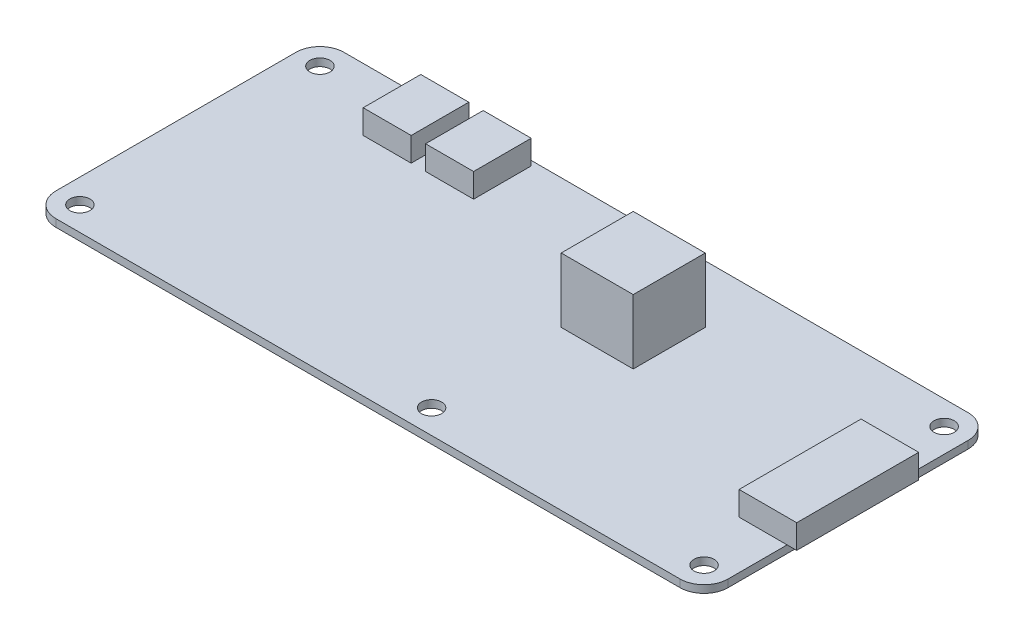
from build123d import *

# Parameters (mm, degrees)
SKETCH2_R           = 2.1
BOSS_EXTRUDE1_DEPTH = 1.5748
SKETCH3_W           = 12
SKETCH3_H           = 25.4
SKETCH3_W_2         = 10
SKETCH3_H_2         = 12
BOSS_EXTRUDE2_DEPTH = 5
SKETCH5_W           = 15
SKETCH5_H           = 15
BOSS_EXTRUDE3_DEPTH = 13.4252


with BuildPart() as part:
    # Sketch2 → Boss-Extrude1 (new body)
    with BuildSketch(Plane(origin=(0, 0, 0), x_dir=(1, 0, 0), z_dir=(0, 1, 0))):
        with BuildLine():
            Line((5, 0), (135, 0))
            ThreePointArc((135, 0), (138.535533906, 1.464466094), (140, 5))
            Line((140, 5), (140, 55))
            ThreePointArc((140, 55), (138.535533906, 58.535533906), (135, 60))
            Line((135, 60), (5, 60))
            ThreePointArc((5, 60), (1.464466094, 58.535533906), (0, 55))
            Line((0, 55), (0, 5))
            ThreePointArc((0, 5), (1.464466094, 1.464466094), (5, 0))
        make_face()
        with Locations(Location((5, 55, 0), (0, 0, 270))):
            Circle(SKETCH2_R, mode=Mode.SUBTRACT)
        with Locations(Location((5, 5, 0), (0, 0, 270))):
            Circle(SKETCH2_R, mode=Mode.SUBTRACT)
        with Locations(Location((135, 5, 0), (0, 0, 270))):
            Circle(SKETCH2_R, mode=Mode.SUBTRACT)
        with Locations(Location((135, 55, 0), (0, 0, 270))):
            Circle(SKETCH2_R, mode=Mode.SUBTRACT)
        with Locations(Location((78.249999964, 55, 0), (0, 0, 270))):
            Circle(SKETCH2_R, mode=Mode.SUBTRACT)
        with Locations(Location((78.249999964, 5, 0), (0, 0, 270))):
            Circle(SKETCH2_R, mode=Mode.SUBTRACT)
    extrude(amount=BOSS_EXTRUDE1_DEPTH)

    # Sketch3 → Boss-Extrude2 (add)
    with BuildSketch(Plane(origin=(0, 1.5748, 0), x_dir=(1, 0, 0), z_dir=(0, 1, 0))):
        with Locations((136, 30)):
            Rectangle(SKETCH3_W, SKETCH3_H)
        with Locations((40, 53)):
            Rectangle(SKETCH3_W_2, SKETCH3_H_2)
        with Locations((27, 53)):
            Rectangle(SKETCH3_W_2, SKETCH3_H_2)
    extrude(amount=BOSS_EXTRUDE2_DEPTH)

    # Sketch5 → Boss-Extrude3 (add)
    with BuildSketch(Plane(origin=(0, 1.5748, 0), x_dir=(1, 0, 0), z_dir=(0, 1, 0))):
        with Locations((84.749999964, 40.5)):
            Rectangle(SKETCH5_W, SKETCH5_H)
    extrude(amount=BOSS_EXTRUDE3_DEPTH)


solid = part.part
